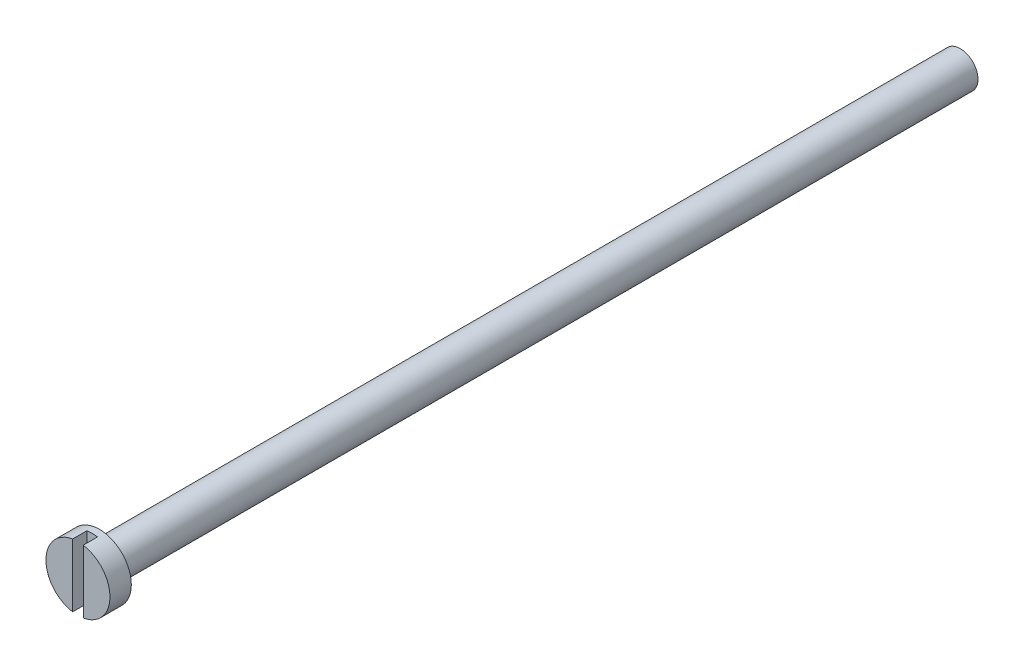
from build123d import *

# Parameters (mm, degrees)
SKETCH_1_R          = 2.5
EXTRUDE_1_DEPTH     = 121
SKETCH_2_R          = 4.5
EXTRUDE_2_DEPTH     = 3
SKETCH_4_W          = 1.5
SKETCH_4_H          = 10.936891942
CUT_EXTRUDE_1_DEPTH = 2


with BuildPart() as part:
    # 草图1 → 凸台-拉伸1 (new body)
    with BuildSketch(Plane.XY):
        Circle(SKETCH_1_R)
    extrude(amount=EXTRUDE_1_DEPTH)

    # 草图2 → 凸台-拉伸2 (add)
    with BuildSketch(Plane.XY.offset(121)):
        Circle(SKETCH_2_R)
    extrude(amount=EXTRUDE_2_DEPTH)

    # 草图4 → 切除-拉伸1 (cut)
    with BuildSketch(Plane.XY.offset(124)):
        Rectangle(SKETCH_4_W, SKETCH_4_H)
    extrude(amount=-CUT_EXTRUDE_1_DEPTH, mode=Mode.SUBTRACT)


solid = part.part
